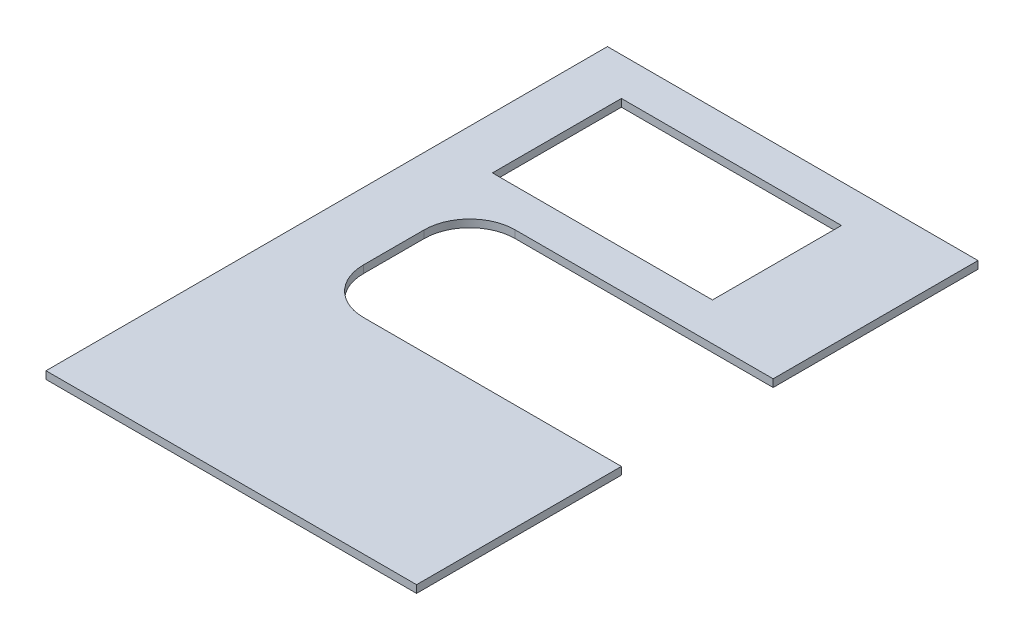
from build123d import *

# Parameters (mm, degrees)
SKETCH1_W           = 310.134
SKETCH1_H           = 469.9
BOSS_EXTRUDE1_DEPTH = 6.35
SKETCH2_W           = 254
SKETCH2_H           = 127
CUT_EXTRUDE1_DEPTH  = 564.053665698
FILLET1_R           = 38.1
SKETCH3_W           = 184.15
SKETCH3_H           = 107.95
CUT_EXTRUDE2_DEPTH  = 564.053665698


with BuildPart() as part:
    # Sketch1 → Boss-Extrude1 (new body)
    with BuildSketch(Plane(origin=(0, 0, 0), x_dir=(1, 0, 0), z_dir=(0, 1, 0))):
        with Locations((155.067, 234.95)):
            Rectangle(SKETCH1_W, SKETCH1_H)
    extrude(amount=BOSS_EXTRUDE1_DEPTH)

    # Sketch2 → Cut-Extrude1 (cut, through all)
    with BuildSketch(Plane(origin=(0, 6.35, 0), x_dir=(1, 0, 0), z_dir=(0, 1, 0))):
        with Locations((183.134, 234.95)):
            Rectangle(SKETCH2_W, SKETCH2_H)
    extrude(amount=-CUT_EXTRUDE1_DEPTH, mode=Mode.SUBTRACT)

    # Fillet1
    fillet1_edges = [part.edges().sort_by_distance(p)[0] for p in [
        (56.134, 3.175, -171.45),
        (56.134, 3.175, -298.45),
    ]]
    fillet(fillet1_edges, radius=FILLET1_R)

    # Sketch3 → Cut-Extrude2 (cut, through all)
    with BuildSketch(Plane(origin=(0, 6.35, 0), x_dir=(1, 0, 0), z_dir=(0, 1, 0))):
        with Locations((135.509, 384.175)):
            Rectangle(SKETCH3_W, SKETCH3_H)
    extrude(amount=-CUT_EXTRUDE2_DEPTH, mode=Mode.SUBTRACT)


solid = part.part
